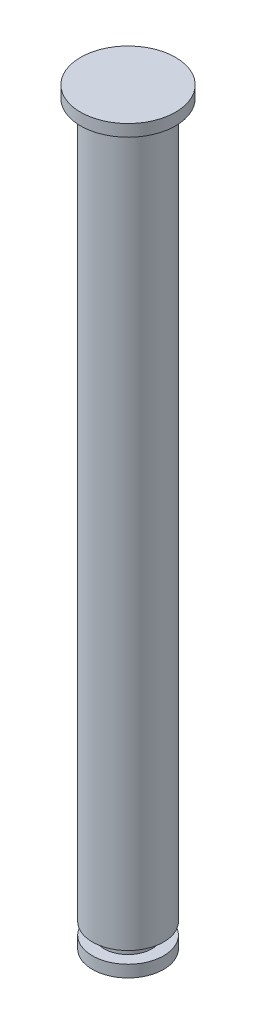
from build123d import *

# Parameters (mm, degrees)
SKETCH_4_W = 1
SKETCH_4_H = 1


with BuildPart() as part:
    # 草图1 → 旋转1 (revolve)
    with BuildSketch(Plane(origin=(0, 0, 0), x_dir=(0, 0, -1), z_dir=(1, 0, 0))):
        Polygon((0, 63), (4, 63), (4, 62), (3, 62), (3, 0), (0, 0), align=None)
    revolve(axis=Axis((0, 0, 0), (0, 1, 0)))

    # 草图4 → 切除-旋转1 (revolve, cut)
    with BuildSketch(Plane.XY, mode=Mode.PRIVATE) as cut_revolve_1_sk:
        with Locations((2.5, 1.5)):
            Rectangle(SKETCH_4_W, SKETCH_4_H)
    revolve(cut_revolve_1_sk.sketch.rotate(Axis((0, 0, 0), (0, 1, 0)), 90), axis=Axis((0, 0, 0), (0, 1, 0)), mode=Mode.SUBTRACT)


solid = part.part
